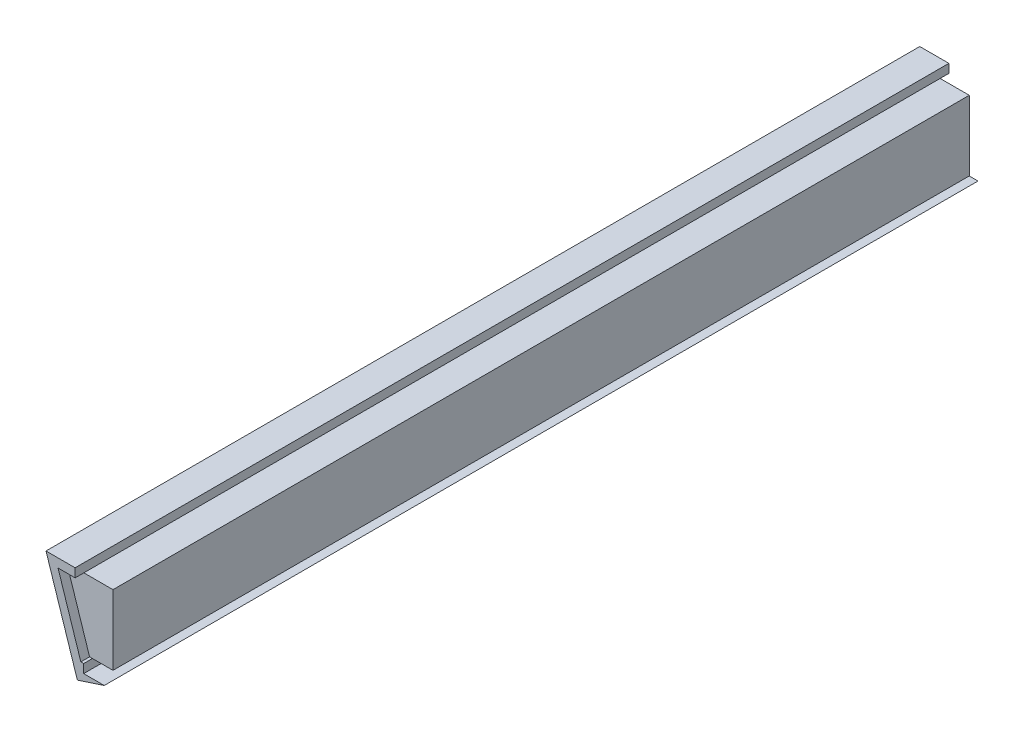
from build123d import *

# Parameters (mm, degrees)
BOSS_EXTRUDE1_DEPTH = 300
CUT_EXTRUDE1_DEPTH  = 3
CUT_EXTRUDE2_DEPTH  = 3


with BuildPart() as part:
    # Sketch1 → Boss-Extrude1 (new body)
    with BuildSketch(Plane.XY):
        Polygon((-105.938079236, 296), (-95.173448736, 262.988466467), (-85.938079236, 266), (-93, 266), (-93, 269), (-85.938079236, 269), (-85.938079236, 293), (-95.938079236, 293), (-95.938079236, 296), align=None)
    extrude(amount=-BOSS_EXTRUDE1_DEPTH)

    # Sketch2 → Cut-Extrude1 (cut)
    with BuildSketch(Plane(origin=(0, 0, -300), x_dir=(-1, 0, 0), z_dir=(0, 0, -1))):
        Polygon((93, 269), (93.97826087, 269), (101.804347826, 293), (95.938079236, 293), (85.938079236, 293), (85.938079236, 269), align=None)
    extrude(amount=-CUT_EXTRUDE1_DEPTH, mode=Mode.SUBTRACT)

    # Sketch3 → Cut-Extrude2 (cut)
    with BuildSketch(Plane.XY):
        Polygon((-101.804347826, 293), (-93.97826087, 269), (-93, 269), (-85.938079236, 269), (-85.938079236, 293), (-95.938079236, 293), align=None)
    extrude(amount=-CUT_EXTRUDE2_DEPTH, mode=Mode.SUBTRACT)


solid = part.part
